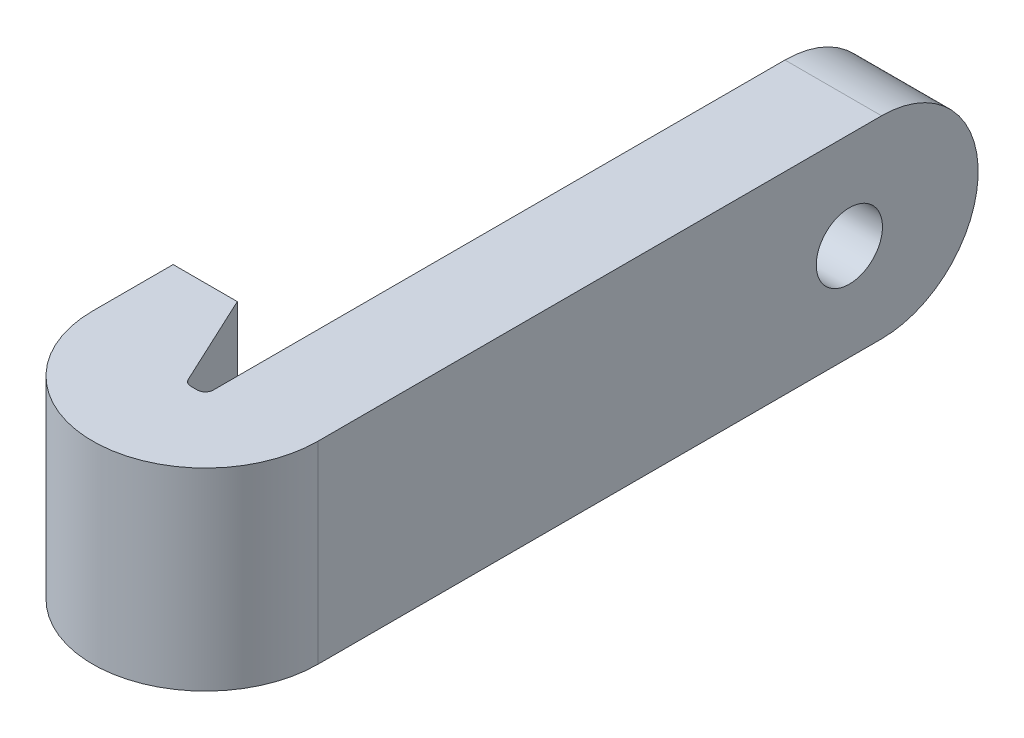
from build123d import *

# Parameters (mm, degrees)
BOSS_EXTRUDE1_DEPTH   = 9.525
FILLET1_R             = 0.396875
FILLET3_RADIUS        = 5.55625
FILLET3_LENGTH        = 9.525
FILLET4_RADIUS        = 4.7625
FILLET4_LENGTH        = 4.7625
F_4_CLEARANCE_HOLE1_D = 3.2639


with BuildPart() as part:
    # Sketch1 → Boss-Extrude1 (new body)
    with BuildSketch(Plane(origin=(0, 0, 0), x_dir=(1, 0, 0), z_dir=(0, 1, 0))):
        Polygon((0, 0), (-7.9375, 0), (-7.9375, 9.525), (-4.773490222, 9.525), (-2.5527, 4.7625), (-1.5875, 4.7625), (-1.5875, 38.1), (3.175, 38.1), (3.175, 0), align=None)
    extrude(amount=BOSS_EXTRUDE1_DEPTH)

    # Fillet1
    fillet1_edges = [part.edges().sort_by_distance(p)[0] for p in [
        (-2.5527, 4.7625, -4.7625),
        (-1.5875, 4.7625, -4.7625),
    ]]
    fillet(fillet1_edges, radius=FILLET1_R)

    # Fillet3: full round fillet: the end face becomes a half cylinder, R = half its width
    fillet3_face = Plane((-2.38125, 4.7625, 0), x_dir=(0, -1, 0), z_dir=(0, 0, 1))  # on the end face: x along it, z out of the body
    fillet3_slab = fillet3_face.offset(-FILLET3_RADIUS / 2) * Box(FILLET3_LENGTH, 2 * FILLET3_RADIUS, FILLET3_RADIUS, mode=Mode.PRIVATE)  # the body's end, R deep
    fillet3_round = Plane((-2.38125, 4.7625, -5.55625), x_dir=(0, 0, 1), z_dir=(0, -1, 0)) * Cylinder(FILLET3_RADIUS, FILLET3_LENGTH, mode=Mode.PRIVATE)  # its axis R under the face
    add(fillet3_slab - fillet3_round, mode=Mode.SUBTRACT)

    # Fillet4: full round fillet: the end face becomes a half cylinder, R = half its width
    fillet4_face = Plane((0.79375, 4.7625, -38.1), x_dir=(1, 0, 0), z_dir=(0, 0, -1))  # on the end face: x along it, z out of the body
    fillet4_slab = fillet4_face.offset(-FILLET4_RADIUS / 2) * Box(FILLET4_LENGTH, 2 * FILLET4_RADIUS, FILLET4_RADIUS, mode=Mode.PRIVATE)  # the body's end, R deep
    fillet4_round = Plane((0.79375, 4.7625, -33.3375), x_dir=(0, 0, -1), z_dir=(1, 0, 0)) * Cylinder(FILLET4_RADIUS, FILLET4_LENGTH, mode=Mode.PRIVATE)  # its axis R under the face
    add(fillet4_slab - fillet4_round, mode=Mode.SUBTRACT)

    # #4 Clearance Hole1 (through all)
    with Locations(Plane(origin=(3.175, 0, 0), x_dir=(0, 0, -1), z_dir=(1, 0, 0))):
        with Locations((31.75, 4.7625)):
            Hole(F_4_CLEARANCE_HOLE1_D / 2)


solid = part.part
